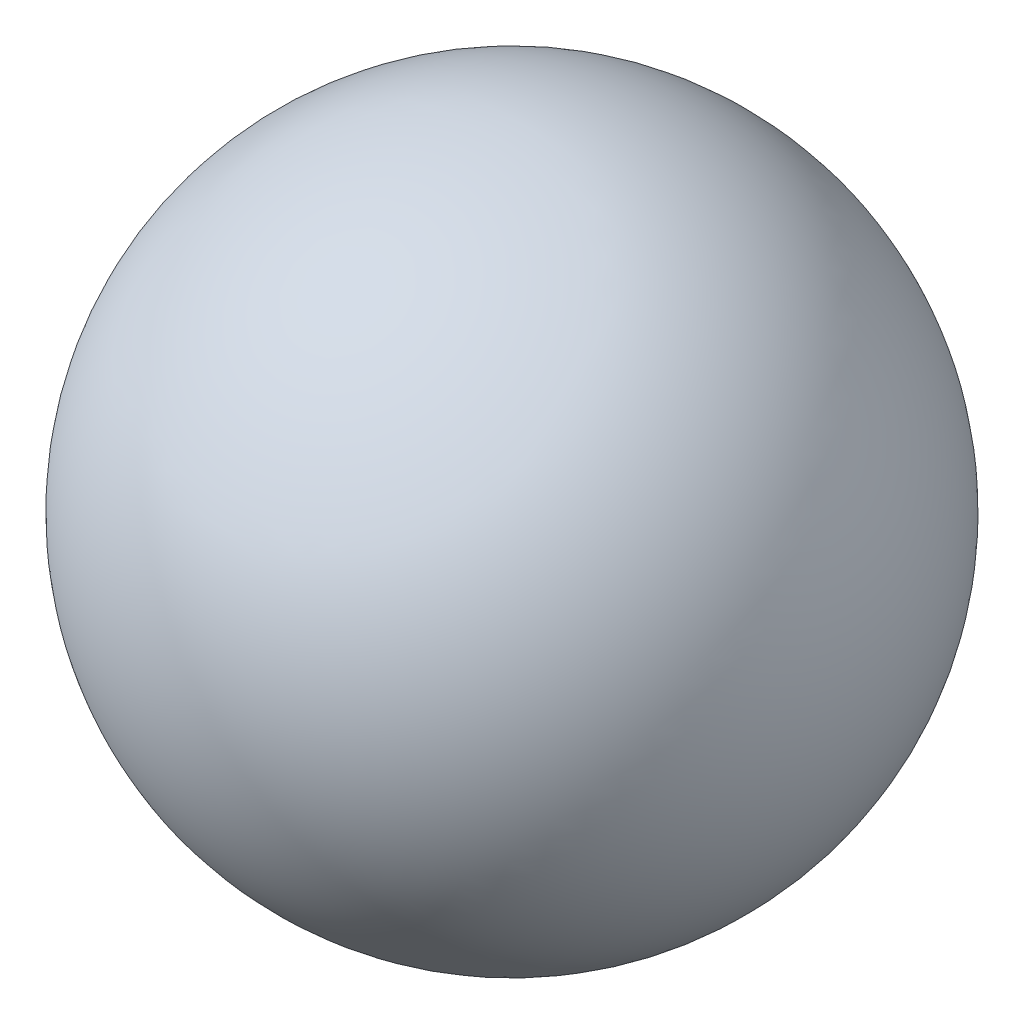
from build123d import *


with BuildPart() as part:
    # Sketch1 → Revolve1 (revolve)
    with BuildSketch(Plane(origin=(0, 0, 0), x_dir=(0, 0, -1), z_dir=(1, 0, 0))):
        with BuildLine():
            Line((-12, 0), (12, 0))
            ThreePointArc((12, 0), (0, -12), (-12, 0))
        make_face()
    revolve(axis=Axis((0, 0, 12), (0, 0, -1)))


solid = part.part
